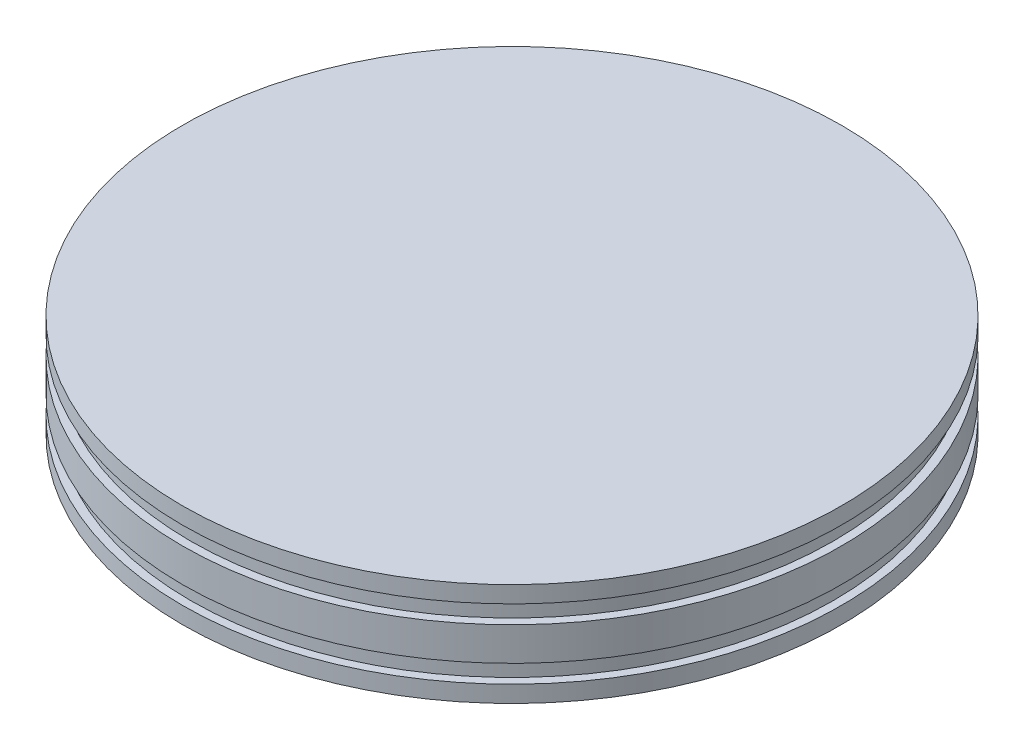
from build123d import *

# Parameters (mm, degrees)
SZKIC1_R                    = 64
DODANIE_WYCI_GNI_CIE1_DEPTH = 20
SZKIC3_W                    = 1.6
SZKIC3_H                    = 3.5


with BuildPart() as part:
    # Szkic1 → Dodanie-wyciągnięcie1 (new body)
    with BuildSketch(Plane(origin=(0, 0, 0), x_dir=(1, 0, 0), z_dir=(0, 1, 0))):
        with Locations(Location((0, 0, 0), (0, 0, 270))):
            Circle(SZKIC1_R)
    extrude(amount=DODANIE_WYCI_GNI_CIE1_DEPTH)

    # Szkic3 → Wycięcie-obrót1 (revolve, cut)
    with BuildSketch(Plane(origin=(0, 0, 0), x_dir=(0, 0, -1), z_dir=(1, 0, 0)), mode=Mode.PRIVATE) as wyci_cie_obr_t1_sk:
        with Locations((-63.2, 15)):
            Rectangle(SZKIC3_W, SZKIC3_H)
        with Locations((-63.2, 5)):
            Rectangle(SZKIC3_W, SZKIC3_H)
    revolve(wyci_cie_obr_t1_sk.sketch.rotate(Axis((0, 0, 0), (0, 1, 0)), 180), axis=Axis((0, 0, 0), (0, 1, 0)), mode=Mode.SUBTRACT)


solid = part.part
